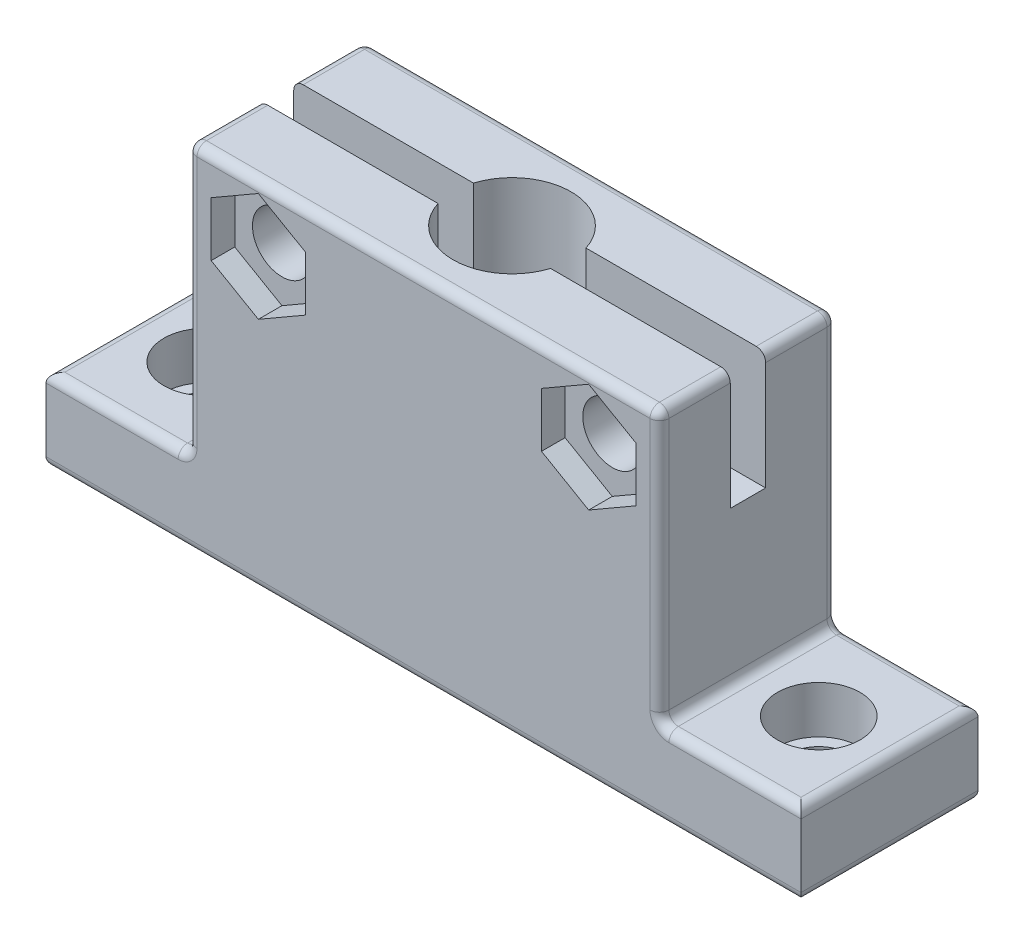
from build123d import *

# Parameters (mm, degrees)
SKETCH_1_W          = 64
SKETCH_1_H          = 15
EXTRUDE_1_DEPTH     = 7
SKETCH_2_W          = 40
SKETCH_2_H          = 15
EXTRUDE_2_DEPTH     = 23
SKETCH_3_R          = 5
CUT_EXTRUDE_1_DEPTH = 20
SKETCH_4_W          = 40
SKETCH_4_H          = 3
CUT_EXTRUDE_2_DEPTH = 10
HOLE_WIZARD_M5_1_D  = 5
SKETCH_8_R          = 3.5
CUT_EXTRUDE_3_DEPTH = 4
HOLE_WIZARD_M5_2_D  = 5
CUT_EXTRUDE_5_DEPTH = 2
FILLET_1_R          = 0.8


with BuildPart() as part:
    # 草图1 → 凸台-拉伸1 (new body)
    with BuildSketch(Plane(origin=(0, 0, 0), x_dir=(1, 0, 0), z_dir=(0, 1, 0))):
        Rectangle(SKETCH_1_W, SKETCH_1_H)
    extrude(amount=EXTRUDE_1_DEPTH)

    # 草图2 → 凸台-拉伸2 (add)
    with BuildSketch(Plane(origin=(0, 7, 0), x_dir=(1, 0, 0), z_dir=(0, 1, 0))):
        Rectangle(SKETCH_2_W, SKETCH_2_H)
    extrude(amount=EXTRUDE_2_DEPTH)

    # 草图3 → 切除-拉伸1 (cut)
    with BuildSketch(Plane(origin=(0, 30, 0), x_dir=(1, 0, 0), z_dir=(0, 1, 0))):
        with Locations(Location((0, 0, 0), (0, 0, 270))):
            Circle(SKETCH_3_R)
    extrude(amount=-CUT_EXTRUDE_1_DEPTH, mode=Mode.SUBTRACT)

    # 草图4 → 切除-拉伸2 (cut)
    with BuildSketch(Plane(origin=(0, 30, 0), x_dir=(1, 0, 0), z_dir=(0, 1, 0))):
        Rectangle(SKETCH_4_W, SKETCH_4_H)
    extrude(amount=-CUT_EXTRUDE_2_DEPTH, mode=Mode.SUBTRACT)

    # M5 螺纹孔的螺纹孔钻头1 (through all)
    with Locations(Plane.XY.offset(7.5)):
        with Locations((-14, 24.5), (14, 24.5)):
            Hole(HOLE_WIZARD_M5_1_D / 2)

    # 草图8 → 切除-拉伸3 (cut)
    with BuildSketch(Plane(origin=(0, 7, 0), x_dir=(1, 0, 0), z_dir=(0, 1, 0))):
        with Locations(Location((-26, 0, 0), (0, 0, 270))):
            Circle(SKETCH_8_R)
    cut_extrude_3 = extrude(amount=-CUT_EXTRUDE_3_DEPTH, mode=Mode.SUBTRACT)

    # M5 螺纹孔的螺纹孔钻头2 (through all)
    with Locations(Plane(origin=(0, 3, 0), x_dir=(1, 0, 0), z_dir=(0, 1, 0))):
        with Locations((-26, 0)):
            hole_wizard_m5_2 = Hole(HOLE_WIZARD_M5_2_D / 2)

    # 镜向1: 切除-拉伸3, M5 螺纹孔的螺纹孔钻头2 across plane
    add(cut_extrude_3.mirror(Plane(origin=(0, 0, 0), x_dir=(0, 0, 1), z_dir=(1, 0, 0))), mode=Mode.SUBTRACT)
    add(hole_wizard_m5_2.mirror(Plane(origin=(0, 0, 0), x_dir=(0, 0, 1), z_dir=(1, 0, 0))), mode=Mode.SUBTRACT)

    # 草图12 → 切除-拉伸5 (cut)
    with BuildSketch(Plane.XY.offset(7.5)):
        Polygon((-14, 19.881197846), (-10, 22.190598923), (-10, 26.809401077), (-14, 29.118802154), (-18, 26.809401077), (-18, 22.190598923), align=None)
        Polygon((14, 19.881197846), (18, 22.190598923), (18, 26.809401077), (14, 29.118802154), (10, 26.809401077), (10, 22.190598923), align=None)
    extrude(amount=-CUT_EXTRUDE_5_DEPTH, mode=Mode.SUBTRACT)

    # 圆角1
    fillet_1_edges = [part.edges().sort_by_distance(p)[0] for p in [
        (-32, 7, 0),
        (-26, 7, -7.5),
        (26, 7, 7.5),
        (20, 7, 0),
        (20, 18.5, 7.5),
        (20, 18.5, -7.5),
        (-20, 7, 0),
        (-20, 18.5, -7.5),
        (-26, 7, 7.5),
        (-20, 18.5, 7.5),
        (20, 30, 4.5),
        (0, 30, -7.5),
        (-20, 30, -4.5),
        (0, 30, 7.5),
        (20, 30, -4.5),
        (-20, 30, 4.5),
        (32, 7, 0),
        (0, 0, 7.5),
        (-32, 0, 0),
        (0, 0, -7.5),
        (32, 0, 0),
        (26, 7, -7.5),
    ]]
    fillet(fillet_1_edges, radius=FILLET_1_R)


solid = part.part
